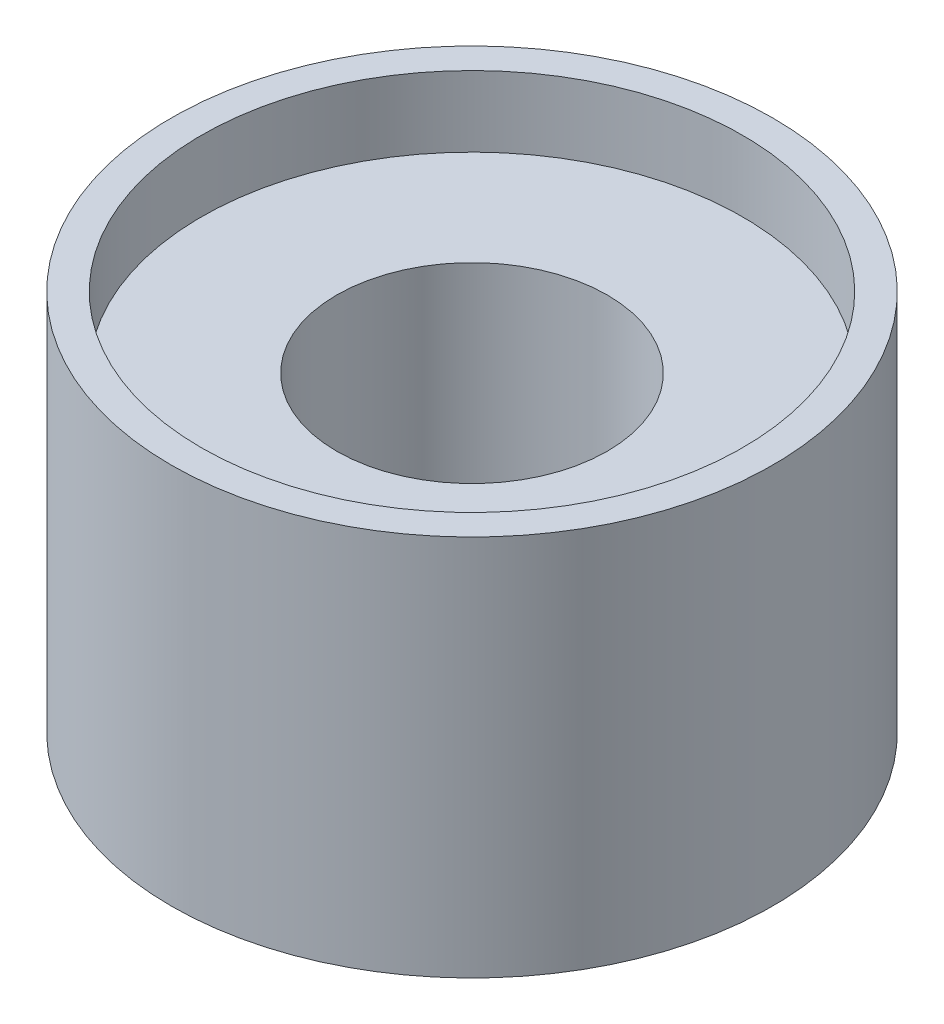
from build123d import *

# Parameters (mm, degrees)
SKETCH1_R           = 100
SKETCH1_R_2         = 90
BOSS_EXTRUDE1_DEPTH = 63.5
SKETCH4_R           = 90
SKETCH4_R_2         = 45
BOSS_EXTRUDE2_DEPTH = 40


with BuildPart() as part:
    # Sketch1 → Boss-Extrude1 (new, symmetric)
    with BuildSketch(Plane(origin=(0, 0, 0), x_dir=(1, 0, 0), z_dir=(0, 1, 0))):
        with Locations(Location((0, 0, 0), (0, 0, 270))):
            Circle(SKETCH1_R)
        with Locations(Location((0, 0, 0), (0, 0, 270))):
            Circle(SKETCH1_R_2, mode=Mode.SUBTRACT)
    extrude(amount=BOSS_EXTRUDE1_DEPTH, both=True)

    # Sketch4 → Boss-Extrude2 (add, symmetric)
    with BuildSketch(Plane(origin=(0, 0, 0), x_dir=(1, 0, 0), z_dir=(0, 1, 0))):
        with Locations(Location((0, 0, 0), (0, 0, 270))):
            Circle(SKETCH4_R)
        with Locations(Location((0, 0, 0), (0, 0, 270))):
            Circle(SKETCH4_R_2, mode=Mode.SUBTRACT)
    extrude(amount=BOSS_EXTRUDE2_DEPTH, both=True)


solid = part.part
